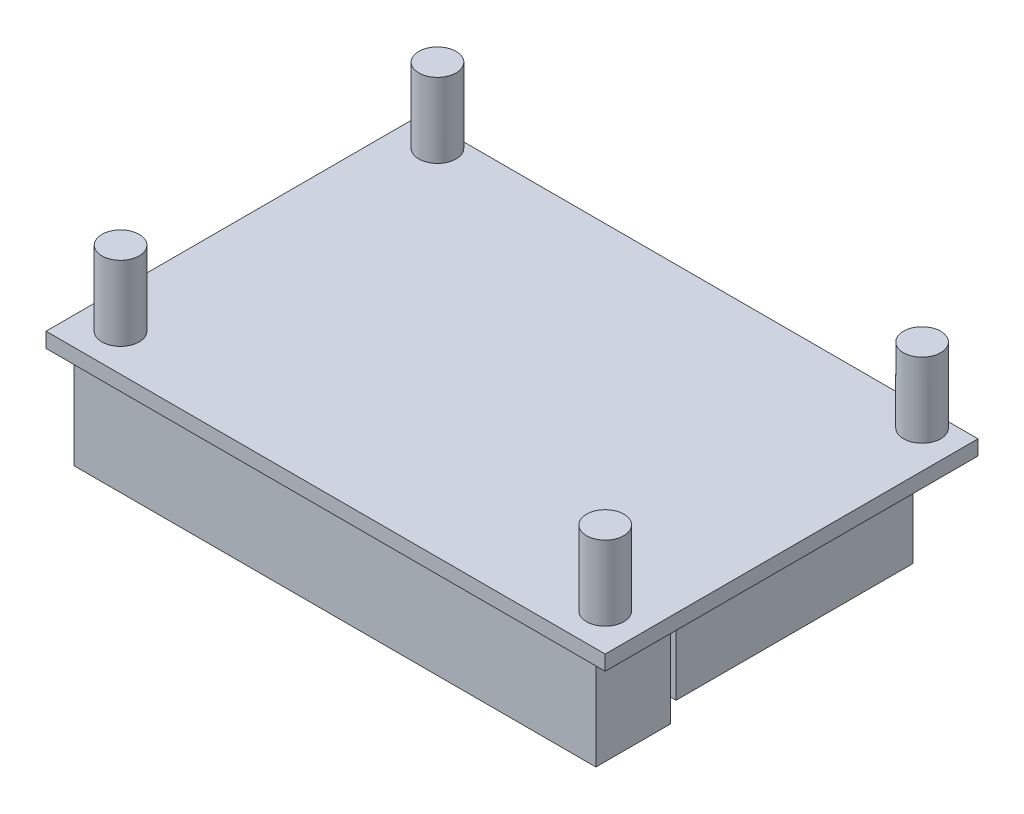
from build123d import *

# Parameters (mm, degrees)
P01_STANDOFF_START             = 14.3
SK_P01_STANDOFF_R              = 2
P01_STANDOFF_DEPTH             = 8
P02_STANDOFF_START             = 14.3
SK_P02_STANDOFF_R              = 2
P02_STANDOFF_DEPTH             = 8
P03_STANDOFF_START             = 14.3
SK_P03_STANDOFF_R              = 2
P03_STANDOFF_DEPTH             = 8
P04_STANDOFF_START             = 14.3
SK_P04_STANDOFF_R              = 2
P04_STANDOFF_DEPTH             = 8
P05_CARRIERBOARD_START         = 12.7
SK_P05_CARRIERBOARD_W          = 60
SK_P05_CARRIERBOARD_H          = 40
P05_CARRIERBOARD_DEPTH         = 1.6
P06_INA2603SENSOR_START        = 10
SK_P06_INA2603SENSOR_W         = 22.9
SK_P06_INA2603SENSOR_H         = 23
P06_INA2603SENSOR_DEPTH        = 2.7
SK_P07_INA260TERMINALBLOCK_W   = 10
SK_P07_INA260TERMINALBLOCK_H   = 8
P07_INA260TERMINALBLOCK_DEPTH  = 10
P08_BUCKBD36V50F55V_START      = 3.2
SK_P08_BUCKBD36V50F55V_W       = 25.4
SK_P08_BUCKBD36V50F55V_H       = 25.4
P08_BUCKBD36V50F55V_DEPTH      = 9.5
P09_JSTXHHEADERSFACEDOWN_START = 2.3
SK_P09_JSTXHHEADERSFACEDOWN_W  = 56
SK_P09_JSTXHHEADERSFACEDOWN_H  = 8
P09_JSTXHHEADERSFACEDOWN_DEPTH = 10.4


with BuildPart() as part:
    # SK_P01_Standoff → P01_Standoff (new body)
    with BuildSketch(Plane(origin=(0, 0, 0), x_dir=(1, 0, 0), z_dir=(0, 1, 0)).offset(P01_STANDOFF_START)):
        with Locations(Location((-26, 18, 0), (0, 0, 270))):
            Circle(SK_P01_STANDOFF_R)
    extrude(amount=P01_STANDOFF_DEPTH)



with BuildPart() as body_2:
    # SK_P02_Standoff → P02_Standoff (new body)
    with BuildSketch(Plane(origin=(0, 0, 0), x_dir=(1, 0, 0), z_dir=(0, 1, 0)).offset(P02_STANDOFF_START)):
        with Locations(Location((-26, -16, 0), (0, 0, 270))):
            Circle(SK_P02_STANDOFF_R)
    extrude(amount=P02_STANDOFF_DEPTH)


with BuildPart() as body_3:
    # SK_P03_Standoff → P03_Standoff (new body)
    with BuildSketch(Plane(origin=(0, 0, 0), x_dir=(1, 0, 0), z_dir=(0, 1, 0)).offset(P03_STANDOFF_START)):
        with Locations(Location((26, 18, 0), (0, 0, 270))):
            Circle(SK_P03_STANDOFF_R)
    extrude(amount=P03_STANDOFF_DEPTH)


with BuildPart() as body_4:
    # SK_P04_Standoff → P04_Standoff (new body)
    with BuildSketch(Plane(origin=(0, 0, 0), x_dir=(1, 0, 0), z_dir=(0, 1, 0)).offset(P04_STANDOFF_START)):
        with Locations(Location((26, -16, 0), (0, 0, 270))):
            Circle(SK_P04_STANDOFF_R)
    extrude(amount=P04_STANDOFF_DEPTH)


with BuildPart() as part_1:
    add(part.part)

    add(body_2.part)  # P05_Carrierboard merges body 2

    add(body_3.part)  # P05_Carrierboard merges body 3

    add(body_4.part)  # P05_Carrierboard merges body 4
    # SK_P05_Carrierboard → P05_Carrierboard (add)
    with BuildSketch(Plane(origin=(0, 0, 0), x_dir=(1, 0, 0), z_dir=(0, 1, 0)).offset(P05_CARRIERBOARD_START)):
        Rectangle(SK_P05_CARRIERBOARD_W, SK_P05_CARRIERBOARD_H)
    extrude(amount=P05_CARRIERBOARD_DEPTH)

    # SK_P06_INA2603sensor → P06_INA2603sensor (add)
    with BuildSketch(Plane(origin=(0, 0, 0), x_dir=(1, 0, 0), z_dir=(0, 1, 0)).offset(P06_INA2603SENSOR_START)):
        with Locations((-16.55, 4.5)):
            Rectangle(SK_P06_INA2603SENSOR_W, SK_P06_INA2603SENSOR_H)
    extrude(amount=P06_INA2603SENSOR_DEPTH)

    # SK_P07_INA260terminalblock → P07_INA260terminalblock (add)
    with BuildSketch(Plane(origin=(0, 0, 0), x_dir=(1, 0, 0), z_dir=(0, 1, 0))):
        with Locations((-20, 10)):
            Rectangle(SK_P07_INA260TERMINALBLOCK_W, SK_P07_INA260TERMINALBLOCK_H)
    extrude(amount=P07_INA260TERMINALBLOCK_DEPTH)

    # SK_P08_BuckBD36V50F55V → P08_BuckBD36V50F55V (add)
    with BuildSketch(Plane(origin=(0, 0, 0), x_dir=(1, 0, 0), z_dir=(0, 1, 0)).offset(P08_BUCKBD36V50F55V_START)):
        with Locations((14.3, 3.3)):
            Rectangle(SK_P08_BUCKBD36V50F55V_W, SK_P08_BUCKBD36V50F55V_H)
    extrude(amount=P08_BUCKBD36V50F55V_DEPTH)

    # SK_P09_JSTXHheadersfacedown → P09_JSTXHheadersfacedown (add)
    with BuildSketch(Plane(origin=(0, 0, 0), x_dir=(1, 0, 0), z_dir=(0, 1, 0)).offset(P09_JSTXHHEADERSFACEDOWN_START)):
        with Locations((0, -15)):
            Rectangle(SK_P09_JSTXHHEADERSFACEDOWN_W, SK_P09_JSTXHHEADERSFACEDOWN_H)
    extrude(amount=P09_JSTXHHEADERSFACEDOWN_DEPTH)


solid = part_1.part
